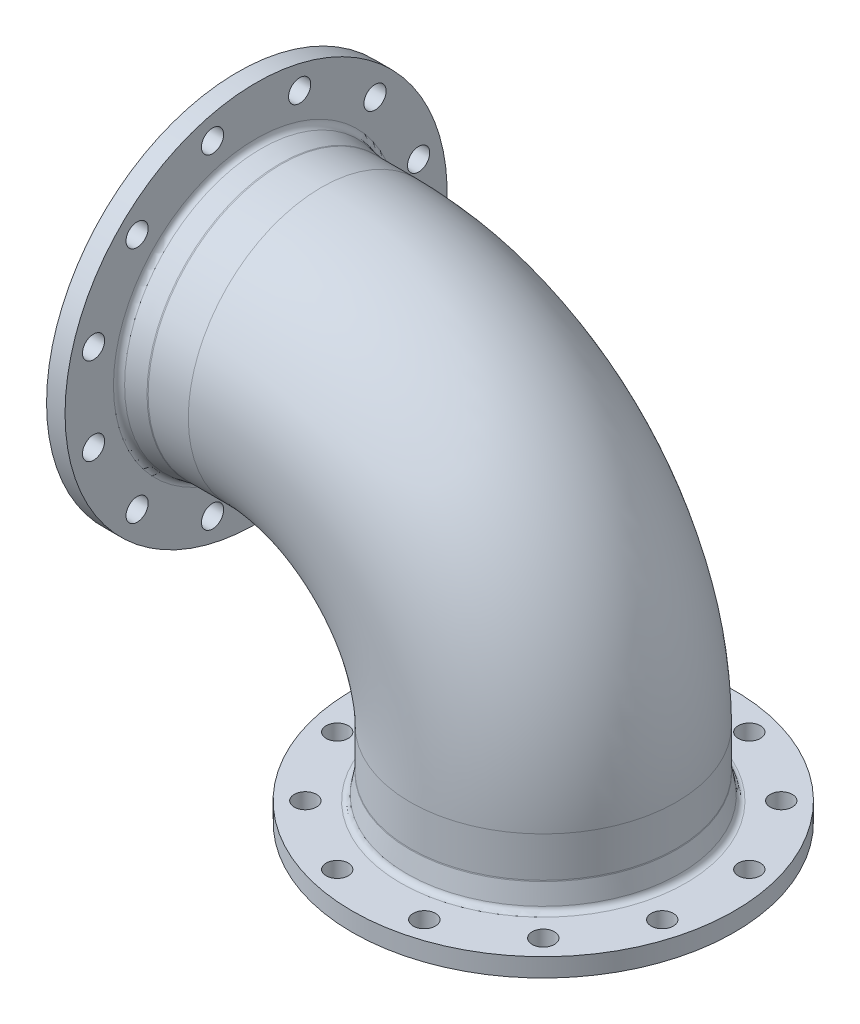
from build123d import *

# Parameters (mm, degrees)
CUT_EXTRUDE_1_REACH = 440.946
SKETCH_4_R          = 9
SKETCH_3_R          = 108
SKETCH_3_R_2        = 100


with BuildPart() as part:
    # Эскиз1 → Повернуть1 (revolve)
    with BuildSketch(Plane.XY, mode=Mode.PRIVATE) as revolve_1_sk:
        with BuildLine():
            Line((0, 350), (0, 375))
            Line((0, 375), (2, 377))
            Line((2, 377), (2, 405))
            Line((2, 405), (17, 405))
            Line((17, 405), (17, 365.72203777))
            ThreePointArc((17, 365.72203777), (18.169777784, 362.508099722), (21.131759112, 360.797999005))
            Line((21.131759112, 360.797999005), (36.569202429, 358.075961235))
            ThreePointArc((36.569202429, 358.075961235), (37.001664604, 358.01902651), (37.437443318, 358))
            Line((37.437443318, 358), (70, 358))
            Line((70, 358), (70, 350))
            Line((70, 350), (0, 350))
        make_face()
    revolve_1 = revolve(revolve_1_sk.sketch.rotate(Axis((0, 250, 0), (1, 0, 0)), 90), axis=Axis((0, 250, 0), (1, 0, 0)))

    # Эскиз4 → Вырез-Вытянуть1 (cut, up to next)
    with BuildSketch(Plane(origin=(2, 0, 0), x_dir=(0, 0, -1), z_dir=(1, 0, 0)), mode=Mode.PRIVATE) as cut_extrude_1_sk1:
        with Locations(Location((-35.328799656, 381.848875288, 0), (0, 0, 180))):
            Circle(SKETCH_4_R)
    cut_extrude_1_tool1 = extrude(cut_extrude_1_sk1.sketch, amount=CUT_EXTRUDE_1_REACH, mode=Mode.PRIVATE) & part.part
    # Эскиз4 → Вырез-Вытянуть1 (cut, up to next)
    with BuildSketch(Plane(origin=(2, 0, 0), x_dir=(0, 0, -1), z_dir=(1, 0, 0)), mode=Mode.PRIVATE) as cut_extrude_1_sk2:
        with Locations(Location((35.328799656, 381.848875288, 0), (0, 0, 180))):
            Circle(SKETCH_4_R)
    cut_extrude_1_tool2 = extrude(cut_extrude_1_sk2.sketch, amount=CUT_EXTRUDE_1_REACH, mode=Mode.PRIVATE) & part.part
    # Эскиз4 → Вырез-Вытянуть1 (cut, up to next)
    with BuildSketch(Plane(origin=(2, 0, 0), x_dir=(0, 0, -1), z_dir=(1, 0, 0)), mode=Mode.PRIVATE) as cut_extrude_1_sk3:
        with Locations(Location((96.520075632, 346.520075632, 0), (0, 0, 180))):
            Circle(SKETCH_4_R)
    cut_extrude_1_tool3 = extrude(cut_extrude_1_sk3.sketch, amount=CUT_EXTRUDE_1_REACH, mode=Mode.PRIVATE) & part.part
    # Эскиз4 → Вырез-Вытянуть1 (cut, up to next)
    with BuildSketch(Plane(origin=(2, 0, 0), x_dir=(0, 0, -1), z_dir=(1, 0, 0)), mode=Mode.PRIVATE) as cut_extrude_1_sk4:
        with Locations(Location((131.848875288, 285.328799656, 0), (0, 0, 180))):
            Circle(SKETCH_4_R)
    cut_extrude_1_tool4 = extrude(cut_extrude_1_sk4.sketch, amount=CUT_EXTRUDE_1_REACH, mode=Mode.PRIVATE) & part.part
    # Эскиз4 → Вырез-Вытянуть1 (cut, up to next)
    with BuildSketch(Plane(origin=(2, 0, 0), x_dir=(0, 0, -1), z_dir=(1, 0, 0)), mode=Mode.PRIVATE) as cut_extrude_1_sk5:
        with Locations(Location((131.848875288, 214.671200344, 0), (0, 0, 180))):
            Circle(SKETCH_4_R)
    cut_extrude_1_tool5 = extrude(cut_extrude_1_sk5.sketch, amount=CUT_EXTRUDE_1_REACH, mode=Mode.PRIVATE) & part.part
    # Эскиз4 → Вырез-Вытянуть1 (cut, up to next)
    with BuildSketch(Plane(origin=(2, 0, 0), x_dir=(0, 0, -1), z_dir=(1, 0, 0)), mode=Mode.PRIVATE) as cut_extrude_1_sk6:
        with Locations(Location((96.520075632, 153.479924368, 0), (0, 0, 180))):
            Circle(SKETCH_4_R)
    cut_extrude_1_tool6 = extrude(cut_extrude_1_sk6.sketch, amount=CUT_EXTRUDE_1_REACH, mode=Mode.PRIVATE) & part.part
    # Эскиз4 → Вырез-Вытянуть1 (cut, up to next)
    with BuildSketch(Plane(origin=(2, 0, 0), x_dir=(0, 0, -1), z_dir=(1, 0, 0)), mode=Mode.PRIVATE) as cut_extrude_1_sk7:
        with Locations(Location((35.328799656, 118.151124712, 0), (0, 0, 180))):
            Circle(SKETCH_4_R)
    cut_extrude_1_tool7 = extrude(cut_extrude_1_sk7.sketch, amount=CUT_EXTRUDE_1_REACH, mode=Mode.PRIVATE) & part.part
    # Эскиз4 → Вырез-Вытянуть1 (cut, up to next)
    with BuildSketch(Plane(origin=(2, 0, 0), x_dir=(0, 0, -1), z_dir=(1, 0, 0)), mode=Mode.PRIVATE) as cut_extrude_1_sk8:
        with Locations(Location((-35.328799656, 118.151124712, 0), (0, 0, 180))):
            Circle(SKETCH_4_R)
    cut_extrude_1_tool8 = extrude(cut_extrude_1_sk8.sketch, amount=CUT_EXTRUDE_1_REACH, mode=Mode.PRIVATE) & part.part
    # Эскиз4 → Вырез-Вытянуть1 (cut, up to next)
    with BuildSketch(Plane(origin=(2, 0, 0), x_dir=(0, 0, -1), z_dir=(1, 0, 0)), mode=Mode.PRIVATE) as cut_extrude_1_sk9:
        with Locations(Location((-96.520075632, 153.479924368, 0), (0, 0, 180))):
            Circle(SKETCH_4_R)
    cut_extrude_1_tool9 = extrude(cut_extrude_1_sk9.sketch, amount=CUT_EXTRUDE_1_REACH, mode=Mode.PRIVATE) & part.part
    # Эскиз4 → Вырез-Вытянуть1 (cut, up to next)
    with BuildSketch(Plane(origin=(2, 0, 0), x_dir=(0, 0, -1), z_dir=(1, 0, 0)), mode=Mode.PRIVATE) as cut_extrude_1_sk10:
        with Locations(Location((-131.848875288, 214.671200344, 0), (0, 0, 180))):
            Circle(SKETCH_4_R)
    cut_extrude_1_tool10 = extrude(cut_extrude_1_sk10.sketch, amount=CUT_EXTRUDE_1_REACH, mode=Mode.PRIVATE) & part.part
    # Эскиз4 → Вырез-Вытянуть1 (cut, up to next)
    with BuildSketch(Plane(origin=(2, 0, 0), x_dir=(0, 0, -1), z_dir=(1, 0, 0)), mode=Mode.PRIVATE) as cut_extrude_1_sk11:
        with Locations(Location((-131.848875288, 285.328799656, 0), (0, 0, 180))):
            Circle(SKETCH_4_R)
    cut_extrude_1_tool11 = extrude(cut_extrude_1_sk11.sketch, amount=CUT_EXTRUDE_1_REACH, mode=Mode.PRIVATE) & part.part
    # Эскиз4 → Вырез-Вытянуть1 (cut, up to next)
    with BuildSketch(Plane(origin=(2, 0, 0), x_dir=(0, 0, -1), z_dir=(1, 0, 0)), mode=Mode.PRIVATE) as cut_extrude_1_sk12:
        with Locations(Location((-96.520075632, 346.520075632, 0), (0, 0, 180))):
            Circle(SKETCH_4_R)
    cut_extrude_1_tool12 = extrude(cut_extrude_1_sk12.sketch, amount=CUT_EXTRUDE_1_REACH, mode=Mode.PRIVATE) & part.part
    cut_extrude_1_1 = cut_extrude_1_tool1.solids().sort_by_distance((2, 381.848875, 35.3288))[0]
    add(cut_extrude_1_1, mode=Mode.SUBTRACT)
    cut_extrude_1_2 = cut_extrude_1_tool2.solids().sort_by_distance((2, 381.848875, -35.3288))[0]
    add(cut_extrude_1_2, mode=Mode.SUBTRACT)
    cut_extrude_1_3 = cut_extrude_1_tool3.solids().sort_by_distance((2, 346.520076, -96.520076))[0]
    add(cut_extrude_1_3, mode=Mode.SUBTRACT)
    cut_extrude_1_4 = cut_extrude_1_tool4.solids().sort_by_distance((2, 285.3288, -131.848875))[0]
    add(cut_extrude_1_4, mode=Mode.SUBTRACT)
    cut_extrude_1_5 = cut_extrude_1_tool5.solids().sort_by_distance((2, 214.6712, -131.848875))[0]
    add(cut_extrude_1_5, mode=Mode.SUBTRACT)
    cut_extrude_1_6 = cut_extrude_1_tool6.solids().sort_by_distance((2, 153.479924, -96.520076))[0]
    add(cut_extrude_1_6, mode=Mode.SUBTRACT)
    cut_extrude_1_7 = cut_extrude_1_tool7.solids().sort_by_distance((2, 118.151125, -35.3288))[0]
    add(cut_extrude_1_7, mode=Mode.SUBTRACT)
    cut_extrude_1_8 = cut_extrude_1_tool8.solids().sort_by_distance((2, 118.151125, 35.3288))[0]
    add(cut_extrude_1_8, mode=Mode.SUBTRACT)
    cut_extrude_1_9 = cut_extrude_1_tool9.solids().sort_by_distance((2, 153.479924, 96.520076))[0]
    add(cut_extrude_1_9, mode=Mode.SUBTRACT)
    cut_extrude_1_10 = cut_extrude_1_tool10.solids().sort_by_distance((2, 214.6712, 131.848875))[0]
    add(cut_extrude_1_10, mode=Mode.SUBTRACT)
    cut_extrude_1_11 = cut_extrude_1_tool11.solids().sort_by_distance((2, 285.3288, 131.848875))[0]
    add(cut_extrude_1_11, mode=Mode.SUBTRACT)
    cut_extrude_1_12 = cut_extrude_1_tool12.solids().sort_by_distance((2, 346.520076, 96.520076))[0]
    add(cut_extrude_1_12, mode=Mode.SUBTRACT)
    cut_extrude_1 = cut_extrude_1_1 + cut_extrude_1_2 + cut_extrude_1_3 + cut_extrude_1_4 + cut_extrude_1_5 + cut_extrude_1_6 + cut_extrude_1_7 + cut_extrude_1_8 + cut_extrude_1_9 + cut_extrude_1_10 + cut_extrude_1_11 + cut_extrude_1_12  # Вырез-Вытянуть1 as one shape, for the pattern or mirror that repeats it

    # По траектории1: sweep along a path in Эскиз2
    with BuildLine(Plane.XY) as sweep_1_path:
        ThreePointArc((70, 250), (197.279220614, 197.279220614), (250, 70))
    # Эскиз3 → По траектории1 (sweep)
    with BuildSketch(Plane(origin=(70, 0, 0), x_dir=(0, 0, -1), z_dir=(1, 0, 0))):
        with Locations((0, 250)):
            Circle(SKETCH_3_R)
        with Locations((0, 250)):
            Circle(SKETCH_3_R_2, mode=Mode.SUBTRACT)
    sweep(path=sweep_1_path.line)

    # Зеркальное отражение1: Повернуть1, Вырез-Вытянуть1 across plane
    add(revolve_1.mirror(Plane(origin=(0, 0, 0), x_dir=(0, 0, 1), z_dir=(0.7071067811865475, -0.7071067811865477, 0))))
    add(cut_extrude_1.mirror(Plane(origin=(0, 0, 0), x_dir=(0, 0, 1), z_dir=(0.7071067811865475, -0.7071067811865477, 0))), mode=Mode.SUBTRACT)


solid = part.part
